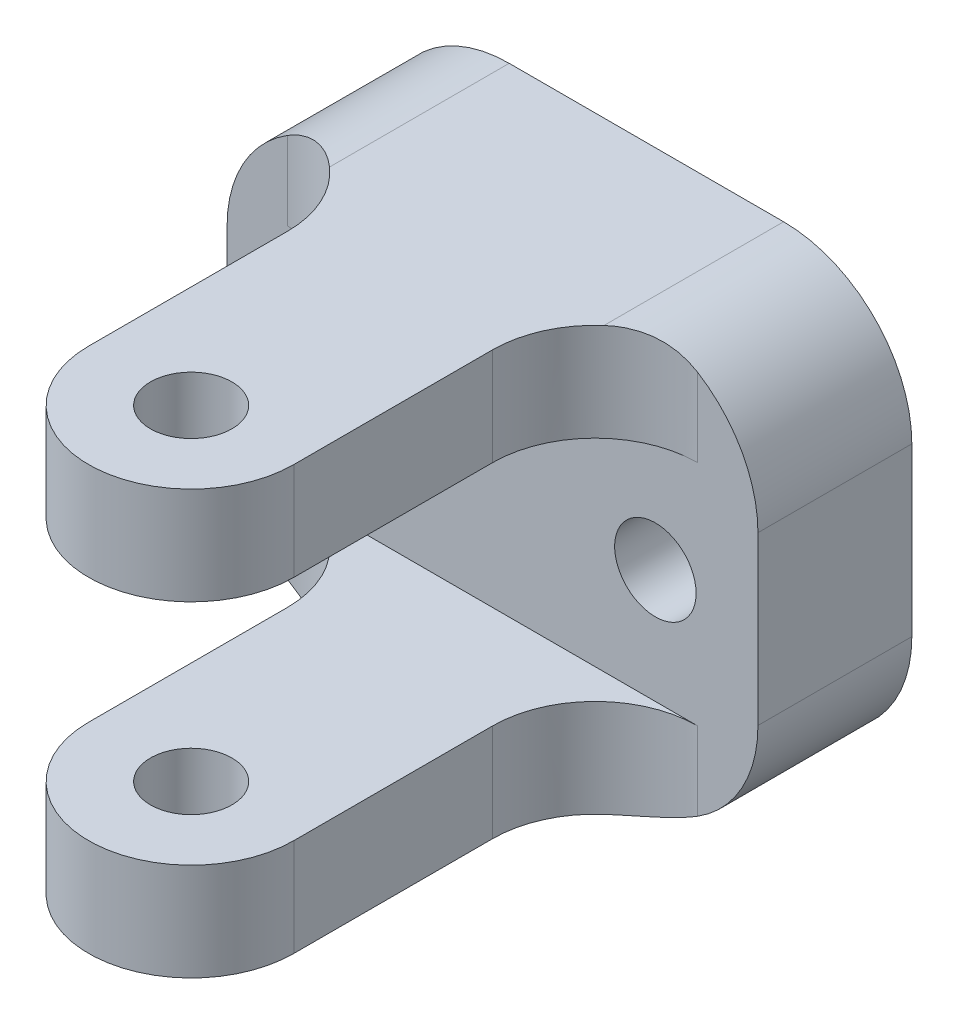
from build123d import *

# Parameters (mm, degrees)
SKETCH1_W                      = 41.4
SKETCH1_H                      = 33.02
SKETCH1_R                      = 3.175
BOSS_EXTRUDE1_DEPTH            = 12
SKETCH2_W                      = 41.4
SKETCH2_H                      = 7.62
BOSS_EXTRUDE2_DEPTH            = 53
CUT_EXTRUDE1_REACH             = 72.186
SKETCH4_R                      = 3.175
CUT_EXTRUDE1_DIRECTION_2_REACH = 72.186
CUT_EXTRUDE3_REACH             = 72.186
CUT_EXTRUDE3_DIRECTION_2_REACH = 72.186
FILLET1_R                      = 10


with BuildPart() as part:
    # Sketch1 → Boss-Extrude1 (new body)
    with BuildSketch(Plane.XY):
        Rectangle(SKETCH1_W, SKETCH1_H)
        with Locations((12.7, 0)):
            Circle(SKETCH1_R, mode=Mode.SUBTRACT)
        with Locations((-12.7, 0)):
            Circle(SKETCH1_R, mode=Mode.SUBTRACT)
    extrude(amount=BOSS_EXTRUDE1_DEPTH)

    # Sketch2 → Boss-Extrude2 (add)
    with BuildSketch(Plane.XY.offset(12)):
        with Locations((0, 12.7)):
            Rectangle(SKETCH2_W, SKETCH2_H)
        with Locations((0, -12.7)):
            Rectangle(SKETCH2_W, SKETCH2_H)
    extrude(amount=BOSS_EXTRUDE2_DEPTH)

    # Cut-Extrude1: up to this face of the body (flat: up to its plane)
    cut_extrude1_end = Plane(part.part.faces().sort_by_distance((0, -16.51, 32.5))[0])
    # Sketch4 → Cut-Extrude1 (cut, up to the picked face)
    with BuildSketch(Plane(origin=(0, 0, 0), x_dir=(1, 0, 0), z_dir=(0, 1, 0)), mode=Mode.PRIVATE) as cut_extrude1_sk1:
        with Locations(Location((0, -35.5, 0), (0, 0, 270))):
            Circle(SKETCH4_R)
    cut_extrude1_tool1 = split(extrude(cut_extrude1_sk1.sketch, amount=-CUT_EXTRUDE1_REACH, mode=Mode.PRIVATE), bisect_by=cut_extrude1_end, keep=Keep.BOTH, mode=Mode.PRIVATE)
    add(cut_extrude1_tool1.solids().sort_by(Axis((0, 0, 35.5), (0, -1, 0)))[0], mode=Mode.SUBTRACT)

    # Cut-Extrude1 direction 2: up to this face of the body (flat: up to its plane)
    cut_extrude1_direction_2_end = Plane(part.part.faces().sort_by_distance((0, 16.51, 32.5))[0])
    # Sketch4 → Cut-Extrude1 direction 2 (cut, up to the picked face)
    with BuildSketch(Plane(origin=(0, 0, 0), x_dir=(1, 0, 0), z_dir=(0, 1, 0)), mode=Mode.PRIVATE) as cut_extrude1_direction_2_sk1:
        with Locations(Location((0, -35.5, 0), (0, 0, 270))):
            Circle(SKETCH4_R)
    cut_extrude1_direction_2_tool1 = split(extrude(cut_extrude1_direction_2_sk1.sketch, amount=CUT_EXTRUDE1_DIRECTION_2_REACH, mode=Mode.PRIVATE), bisect_by=cut_extrude1_direction_2_end, keep=Keep.BOTH, mode=Mode.PRIVATE)
    add(cut_extrude1_direction_2_tool1.solids().sort_by(Axis((0, 0, 35.5), (0, 1, 0)))[0], mode=Mode.SUBTRACT)

    # Cut-Extrude3: up to this face of the body (flat: up to its plane)
    cut_extrude3_end = Plane(part.part.faces().sort_by_distance((-19.929353518, -16.51, 32.5))[0])
    # Sketch6 → Cut-Extrude3 (cut, up to the picked face)
    with BuildSketch(Plane(origin=(0, 0, 0), x_dir=(1, 0, 0), z_dir=(0, 1, 0)), mode=Mode.PRIVATE) as cut_extrude3_sk1:
        with BuildLine():
            Line((-8, -35.5), (-8, -20))
            ThreePointArc((-8, -20), (-10.343145751, -14.343145751), (-16, -12))
            Line((-16, -12), (-20.7, -12))
            Line((-20.7, -12), (-20.7, -65))
            Line((-20.7, -65), (20.7, -65))
            Line((20.7, -65), (20.7, -12))
            Line((20.7, -12), (16, -12))
            ThreePointArc((16, -12), (10.343145751, -14.343145751), (8, -20))
            Line((8, -20), (8, -35.5))
            ThreePointArc((8, -35.5), (0, -43.5), (-8, -35.5))
        make_face()
    cut_extrude3_tool1 = split(extrude(cut_extrude3_sk1.sketch, amount=-CUT_EXTRUDE3_REACH, mode=Mode.PRIVATE), bisect_by=cut_extrude3_end, keep=Keep.BOTH, mode=Mode.PRIVATE)
    add(cut_extrude3_tool1.solids().sort_by(Axis((-8.67253, 0, 27.75), (0, -1, 0)))[0], mode=Mode.SUBTRACT)

    # Cut-Extrude3 direction 2: up to this face of the body (flat: up to its plane)
    cut_extrude3_direction_2_end = Plane(part.part.faces().sort_by_distance((19.929353518, 16.51, 32.5))[0])
    # Sketch6 → Cut-Extrude3 direction 2 (cut, up to the picked face)
    with BuildSketch(Plane(origin=(0, 0, 0), x_dir=(1, 0, 0), z_dir=(0, 1, 0)), mode=Mode.PRIVATE) as cut_extrude3_direction_2_sk1:
        with BuildLine():
            Line((-8, -35.5), (-8, -20))
            ThreePointArc((-8, -20), (-10.343145751, -14.343145751), (-16, -12))
            Line((-16, -12), (-20.7, -12))
            Line((-20.7, -12), (-20.7, -65))
            Line((-20.7, -65), (20.7, -65))
            Line((20.7, -65), (20.7, -12))
            Line((20.7, -12), (16, -12))
            ThreePointArc((16, -12), (10.343145751, -14.343145751), (8, -20))
            Line((8, -20), (8, -35.5))
            ThreePointArc((8, -35.5), (0, -43.5), (-8, -35.5))
        make_face()
    cut_extrude3_direction_2_tool1 = split(extrude(cut_extrude3_direction_2_sk1.sketch, amount=CUT_EXTRUDE3_DIRECTION_2_REACH, mode=Mode.PRIVATE), bisect_by=cut_extrude3_direction_2_end, keep=Keep.BOTH, mode=Mode.PRIVATE)
    add(cut_extrude3_direction_2_tool1.solids().sort_by(Axis((-8.67253, 0, 27.75), (0, 1, 0)))[0], mode=Mode.SUBTRACT)

    # Fillet1
    fillet1_edges = [part.edges().sort_by_distance(p)[0] for p in [
        (-20.7, -16.51, 6),
        (-20.7, 16.51, 6),
        (20.7, -16.51, 6),
        (20.7, 16.51, 6),
    ]]
    fillet(fillet1_edges, radius=FILLET1_R)


solid = part.part
